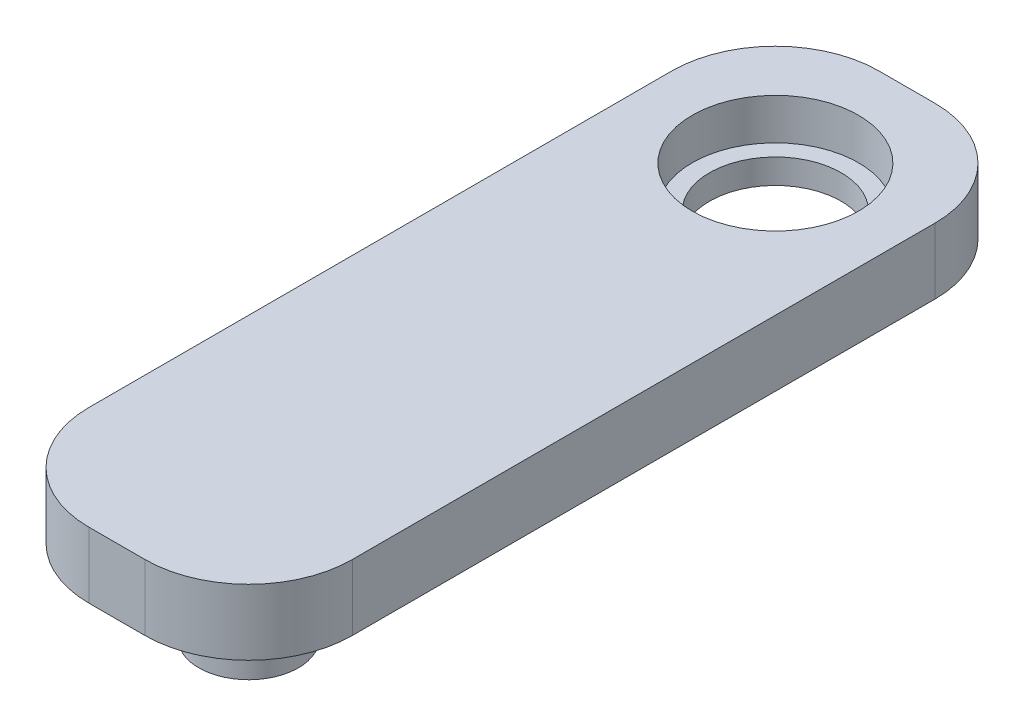
from build123d import *

# Parameters (mm, degrees)
SKETCH1_W           = 25.4
SKETCH1_H           = 76.2
BOSS_EXTRUDE1_DEPTH = 6.35
SKETCH5_R           = 8.016875
CUT_EXTRUDE1_DEPTH  = 3.96875
SKETCH6_R           = 6.35
CUT_EXTRUDE2_DEPTH  = 81.419841933
BOSS_EXTRUDE2_START = -6.35
SKETCH7_R           = 5.55625
BOSS_EXTRUDE2_DEPTH = 4
SKETCH8_R           = 4.805
BOSS_EXTRUDE3_DEPTH = 4
FILLET1_R           = 10


with BuildPart() as part:
    # Sketch1 → Boss-Extrude1 (new body)
    with BuildSketch(Plane(origin=(0, 0, 0), x_dir=(1, 0, 0), z_dir=(0, 1, 0))):
        with Locations((12.7, 38.1)):
            Rectangle(SKETCH1_W, SKETCH1_H)
    extrude(amount=BOSS_EXTRUDE1_DEPTH)

    # Sketch5 → Cut-Extrude1 (cut)
    with BuildSketch(Plane(origin=(0, 6.35, 0), x_dir=(1, 0, 0), z_dir=(0, 1, 0))):
        with Locations(Location((12.7, 63.5, 0), (0, 0, 270))):
            Circle(SKETCH5_R)
    extrude(amount=-CUT_EXTRUDE1_DEPTH, mode=Mode.SUBTRACT)

    # Sketch6 → Cut-Extrude2 (cut, through all)
    with BuildSketch(Plane(origin=(0, 2.38125, 0), x_dir=(1, 0, 0), z_dir=(0, 1, 0))):
        with Locations(Location((12.7, 63.5, 0), (0, 0, 270))):
            Circle(SKETCH6_R)
    extrude(amount=-CUT_EXTRUDE2_DEPTH, mode=Mode.SUBTRACT)

    # Sketch7 → Boss-Extrude2 (add)
    with BuildSketch(Plane(origin=(0, 6.35, 0), x_dir=(1, 0, 0), z_dir=(0, 1, 0)).offset(BOSS_EXTRUDE2_START)):
        with Locations(Location((12.7, 12.7, 0), (0, 0, 90))):
            Circle(SKETCH7_R)
    extrude(amount=-BOSS_EXTRUDE2_DEPTH)

    # Sketch8 → Boss-Extrude3 (add)
    with BuildSketch(Plane.XZ.offset(4)):
        with Locations(Location((12.7, -12.7, 0), (0, 0, 270))):
            Circle(SKETCH8_R)
    extrude(amount=BOSS_EXTRUDE3_DEPTH)

    # Fillet1
    fillet1_edges = [part.edges().sort_by_distance(p)[0] for p in [
        (0, 3.175, -76.2),
        (25.4, 3.175, -76.2),
        (25.4, 3.175, 0),
        (0, 3.175, 0),
    ]]
    fillet(fillet1_edges, radius=FILLET1_R)


solid = part.part
